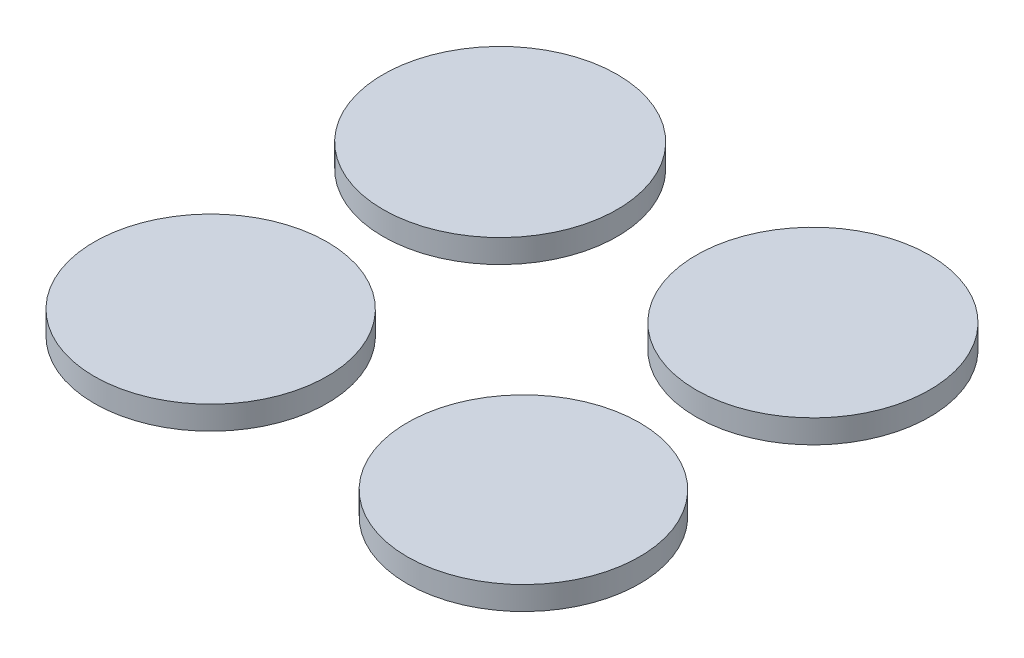
from build123d import *

# Parameters (mm, degrees)
SKETCH1_R             = 20
BOSS_EXTRUDE1_DEPTH   = 4
SKETCH1_R_2           = 19.95
BOSS_EXTRUDE1_2_DEPTH = 4
SKETCH1_R_3           = 19.85
BOSS_EXTRUDE1_3_DEPTH = 4
SKETCH1_R_4           = 19.9
BOSS_EXTRUDE1_4_DEPTH = 4


with BuildPart() as part:
    # Sketch1 → Boss-Extrude1 (new body)
    with BuildSketch(Plane(origin=(0, 0, 0), x_dir=(1, 0, 0), z_dir=(0, 1, 0))):
        with Locations(Location((0, 0, 0), (0, 0, 270))):
            Circle(SKETCH1_R)
    extrude(amount=BOSS_EXTRUDE1_DEPTH)


with BuildPart() as body_2:
    # Sketch1 → Boss-Extrude1 2 (new body)
    with BuildSketch(Plane(origin=(0, 0, 0), x_dir=(1, 0, 0), z_dir=(0, 1, 0))):
        with Locations(Location((53.435659189, 0, 0), (0, 0, 270))):
            Circle(SKETCH1_R_2)
    extrude(amount=BOSS_EXTRUDE1_2_DEPTH)


with BuildPart() as body_3:
    # Sketch1 → Boss-Extrude1 3 (new body)
    with BuildSketch(Plane(origin=(0, 0, 0), x_dir=(1, 0, 0), z_dir=(0, 1, 0))):
        with Locations(Location((53.435659189, -49.462529873, 0), (0, 0, 270))):
            Circle(SKETCH1_R_3)
    extrude(amount=BOSS_EXTRUDE1_3_DEPTH)


with BuildPart() as body_4:
    # Sketch1 → Boss-Extrude1 4 (new body)
    with BuildSketch(Plane(origin=(0, 0, 0), x_dir=(1, 0, 0), z_dir=(0, 1, 0))):
        with Locations(Location((0, -49.462529873, 0), (0, 0, 270))):
            Circle(SKETCH1_R_4)
    extrude(amount=BOSS_EXTRUDE1_4_DEPTH)


solid = Compound([part.part, body_2.part, body_3.part, body_4.part])
